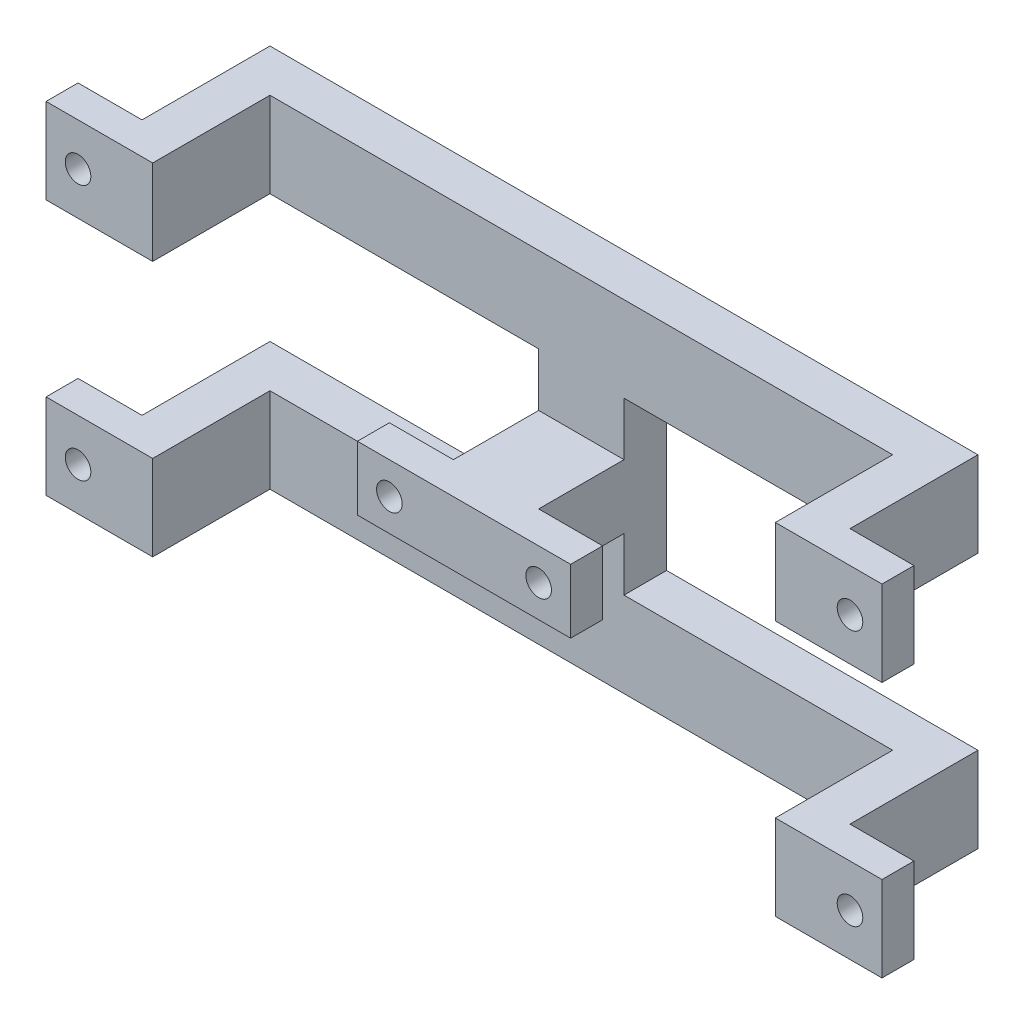
from build123d import *

# Parameters (mm, degrees)
EXTRUDE_1_DEPTH = 2
SKETCH_1_6_W    = 2
SKETCH_1_6_H    = 4
SKETCH_1_6_W_2  = 4
SKETCH_1_6_H_2  = 1.5
EXTRUDE_2_DEPTH = 7.5
EXTRUDE_START   = 7.5
SKETCH_1_7_W    = 3
SKETCH_1_7_H    = 4
SKETCH_1_7_R    = 0.6
EXTRUDE_3_DEPTH = 1.5


with BuildPart() as part:
    # 草图1 → 凸台-拉伸1 (new body)
    with BuildSketch(Plane.XY):
        Polygon((-2, 4), (-2, -4), (-14.6, -4), (-14.6, -8), (14.6, -8), (14.6, -4), (2, -4), (2, 4), (14.6, 4), (14.6, 8), (-14.6, 8), (-14.6, 4), align=None)
    extrude(amount=EXTRUDE_1_DEPTH)

    # 草图1<6> → 凸台-拉伸2 (add)
    with BuildSketch(Plane.XY):
        with Locations((15.6, -6)):
            Rectangle(SKETCH_1_6_W, SKETCH_1_6_H)
        with Locations((15.6, 6)):
            Rectangle(SKETCH_1_6_W, SKETCH_1_6_H)
        with Locations((-15.6, 6)):
            Rectangle(SKETCH_1_6_W, SKETCH_1_6_H)
        with Locations((-15.6, -6)):
            Rectangle(SKETCH_1_6_W, SKETCH_1_6_H)
        with Locations((0, 0.75)):
            Rectangle(SKETCH_1_6_W_2, SKETCH_1_6_H_2)
        with Locations((0, -0.75)):
            Rectangle(SKETCH_1_6_W_2, SKETCH_1_6_H_2)
    extrude(amount=EXTRUDE_2_DEPTH)

    # 草图1<7> → 凸台-拉伸3 (add)
    # profile 1 of 6: a face of its own
    with BuildSketch(Plane.XY.offset(EXTRUDE_START)):
        with Locations((18.1, 6)):
            Rectangle(SKETCH_1_7_W, SKETCH_1_7_H)
        with Locations((18.1, 6)):
            Circle(SKETCH_1_7_R, mode=Mode.SUBTRACT)
    # profile 2 of 6: a face of its own
    with BuildSketch(Plane.XY.offset(EXTRUDE_START)):
        with Locations((18.1, -6)):
            Rectangle(SKETCH_1_7_W, SKETCH_1_7_H)
        with Locations((18.1, -6)):
            Circle(SKETCH_1_7_R, mode=Mode.SUBTRACT)
    # profile 3 of 6: a face of its own
    with BuildSketch(Plane.XY.offset(EXTRUDE_START)):
        with Locations((-18.1, 6)):
            Rectangle(SKETCH_1_7_W, SKETCH_1_7_H)
        with Locations((-18.1, 6)):
            Circle(SKETCH_1_7_R, mode=Mode.SUBTRACT)
    # profile 4 of 6: a face of its own
    with BuildSketch(Plane.XY.offset(EXTRUDE_START)):
        with Locations((-18.1, -6)):
            Rectangle(SKETCH_1_7_W, SKETCH_1_7_H)
        with Locations((-18.1, -6)):
            Circle(SKETCH_1_7_R, mode=Mode.SUBTRACT)
    # profile 5 of 6: a face of its own
    with BuildSketch(Plane.XY.offset(EXTRUDE_START)):
        Polygon((-2, -1.5), (-2, 0), (-2, 1.5), (-5, 1.5), (-5, -1.5), align=None)
        with Locations((-3.5, 0)):
            Circle(SKETCH_1_7_R, mode=Mode.SUBTRACT)
    # profile 6 of 6: a face of its own
    with BuildSketch(Plane.XY.offset(EXTRUDE_START)):
        Polygon((2, 1.5), (2, 0), (2, -1.5), (5, -1.5), (5, 1.5), align=None)
        with Locations((3.5, 0)):
            Circle(SKETCH_1_7_R, mode=Mode.SUBTRACT)
    extrude(amount=-EXTRUDE_3_DEPTH)


solid = part.part
